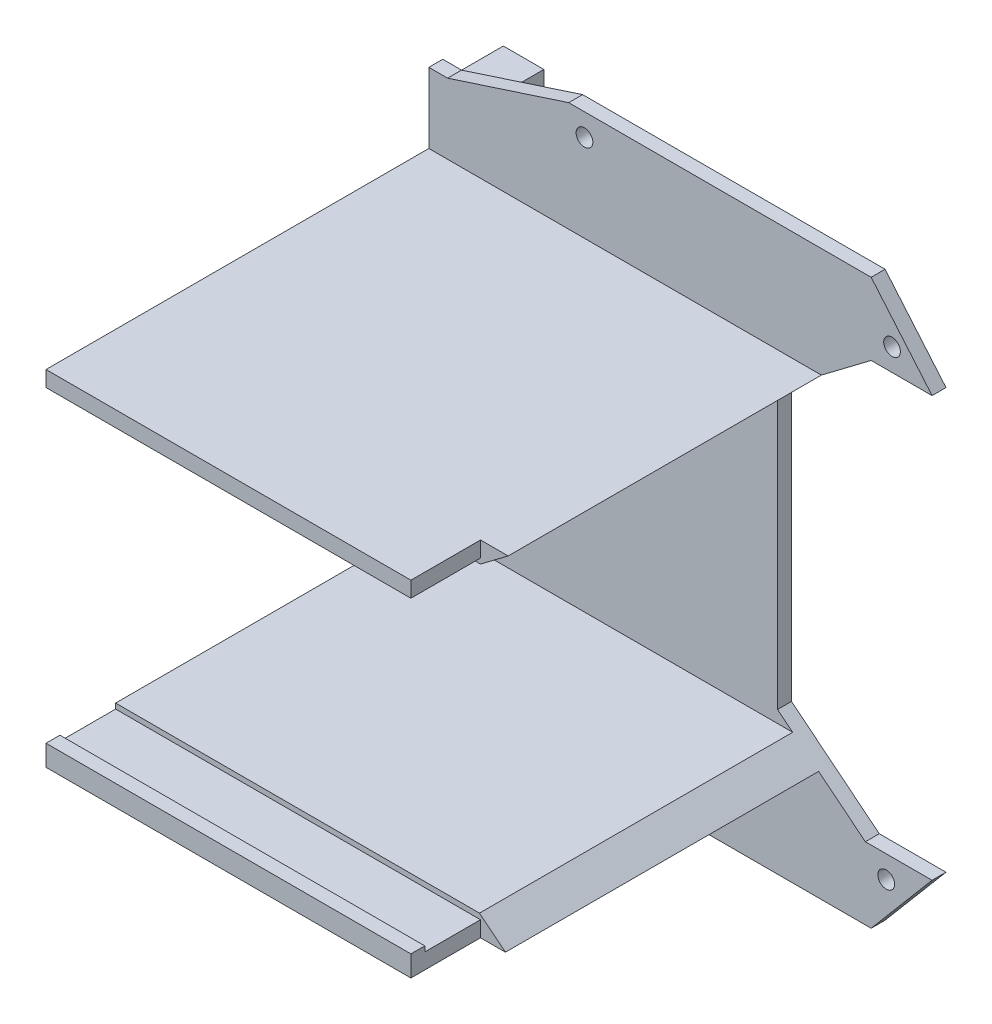
from build123d import *

# Parameters (mm, degrees)
SKETCH_1_R          = 1.2
EXTRUDE_1_DEPTH     = 2
SKETCH_2_W          = 5.828282036
SKETCH_2_H          = 6
EXTRUDE_3_DEPTH     = 6
SKETCH_4_R          = 1.5
CUT_EXTRUDE_1_DEPTH = 5.828282036
EXTRUDE_4_DEPTH     = 45
EXTRUDE_5_DEPTH     = 52.422321


with BuildPart() as part:
    # 草图1 → 凸台-拉伸1 (new body)
    # profile 1 of 3: a face of its own
    with BuildSketch(Plane.XY):
        Polygon((-105.285311989, -8.55), (-141.174369577, -8.55), (-145.174369577, -14.55), (-161.297950566, -14.55), (-164.165207203, -8.55), (-165.3, -8.55), (-165.3, -4.7), (-168, -4.7), (-168, 65), (-165.3, 65), (-159.471717964, 65), (-149.4421323, 68.256733276), (-149.4421323, 63.85), (-141.4421323, 63.85), (-141.4421323, 68.85), (-104.45, 68.85), (-104.45, 60.3), (-117.895945033, 50.15), (-117.895945033, 10.15), (-105.285311989, 0), align=None)
    # profile 2 of 3: a face of its own
    with BuildSketch(Plane.XY):
        Polygon((-141.4421323, 63.85), (-141.4421323, 68.85), (-104.45, 68.85), (-104.45, 60.3), (-95.7, 60.3), (-104.45, 70.65), (-147.9, 70.65), (-165.3, 65), (-159.471717964, 65), (-149.4421323, 68.256733276), (-149.4421323, 63.85), align=None)
        with Locations((-101.45, 63.5)):
            Circle(SKETCH_1_R, mode=Mode.SUBTRACT)
        with Locations((-145.6421323, 67.45)):
            Circle(SKETCH_1_R, mode=Mode.SUBTRACT)
    # profile 3 of 3: a face of its own
    with BuildSketch(Plane.XY):
        Polygon((-105.285311989, 0), (-105.285311989, -8.55), (-141.174369577, -8.55), (-145.174369577, -14.55), (-161.297950566, -14.55), (-164.165207203, -8.55), (-165.3, -8.55), (-165.3, -4.7), (-168, -4.7), (-162.432743363, -16.35), (-141.174369577, -16.35), (-137.174369577, -10.35), (-104.45, -10.35), (-95.7, 0), align=None)
        with Locations((-140.974369577, -12.15)):
            Circle(SKETCH_1_R, mode=Mode.SUBTRACT)
        with Locations((-102.285311989, -3.2)):
            Circle(SKETCH_1_R, mode=Mode.SUBTRACT)
    extrude(amount=EXTRUDE_1_DEPTH)

    # 草图2 → 凸台-拉伸3 (add)
    with BuildSketch(Plane(origin=(0, 0, 0), x_dir=(-1, 0, 0), z_dir=(0, 0, -1))):
        with Locations((162.385858982, 62)):
            Rectangle(SKETCH_2_W, SKETCH_2_H)
        with Locations((162.385858982, -1.7)):
            Rectangle(SKETCH_2_W, SKETCH_2_H)
    extrude(amount=EXTRUDE_3_DEPTH)

    # 草图4 → 切除-拉伸1 (cut)
    with BuildSketch(Plane.ZY.offset(165.3)):
        with Locations(Location((-3.1, 61.9, 0), (0, 0, 270))):
            Circle(SKETCH_4_R)
        with Locations(Location((-3.1, -1.6, 0), (0, 0, 270))):
            Circle(SKETCH_4_R)
    extrude(amount=-CUT_EXTRUDE_1_DEPTH, mode=Mode.SUBTRACT)

    # 草图5 → 凸台-拉伸4 (add)
    with BuildSketch(Plane.XY.offset(2)):
        Polygon((-113, 54.9), (-168, 54.9), (-168, 51.9), (-115.577678648, 51.9), (-111.603507702, 54.9), align=None)
        Polygon((-115.721697956, 8.4), (-168, 8.4), (-168, 5.4), (-113, 5.4), (-111.994417254, 5.4), align=None)
    extrude(amount=EXTRUDE_4_DEPTH)

    # 草图6 → 凸台-拉伸5 (add)
    with BuildSketch(Plane.ZY.offset(168)):
        Polygon((47, 54.9), (47, 52.65), (55, 52.65), (57, 52.65), (57, 54.9), align=None)
        Polygon((55, 7.65), (47, 7.65), (47, 5.4), (57, 5.4), (57, 8.4), (55, 8.4), align=None)
    extrude(amount=-EXTRUDE_5_DEPTH)


solid = part.part
